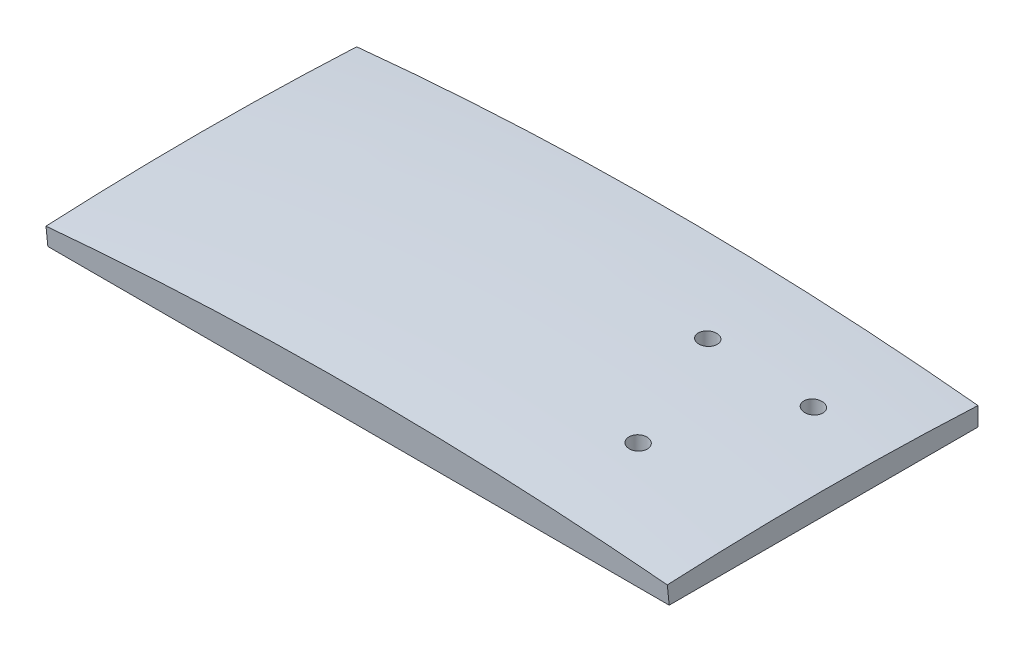
from build123d import *

# Parameters (mm, degrees)
EXTRUDE_2_DEPTH     = 100
SKETCH_7_R          = 1.5
CUT_EXTRUDE_1_DEPTH = 100


with BuildPart() as part:
    # По траектории3: sweep along a path in Эскиз3
    with BuildLine(Plane(origin=(0, 0, 0), x_dir=(0, 0, -1), z_dir=(1, 0, 0))) as sweep_3_path:
        ThreePointArc((0, 3), (-25, 3.625391114), (-50, 3))
    # Эскиз1 → По траектории3 (sweep)
    with BuildSketch(Plane.XY):
        with BuildLine():
            Line((0, 0), (100, 0))
            Line((100, 0), (100, 3))
            ThreePointArc((100, 3), (50, 5.506281447), (0, 3))
            Line((0, 3), (0, 0))
        make_face()
    sweep(path=sweep_3_path.line)

    # Эскиз6 → Бобышка-Вытянуть2 (add)
    with BuildSketch(Plane.ZY):
        Polygon((0, 0), (49.700375235, 0.015), (50, 3), (0, 3), align=None)
    extrude(amount=-EXTRUDE_2_DEPTH)

    # Эскиз7 → Вырез-Вытянуть1 (cut)
    with BuildSketch(Plane(origin=(0, 0, 0), x_dir=(1, 0, 0), z_dir=(0, -0.9999999544557917, 0.00030180857279200576))):
        with Locations(Location((80, 34.700377498, 0), (0, 0, 270))):
            Circle(SKETCH_7_R)
        with Locations(Location((71.5, 15, 0), (0, 0, 270))):
            Circle(SKETCH_7_R)
        with Locations(Location((88.5, 15, 0), (0, 0, 270))):
            Circle(SKETCH_7_R)
    extrude(amount=-CUT_EXTRUDE_1_DEPTH, mode=Mode.SUBTRACT)


solid = part.part
